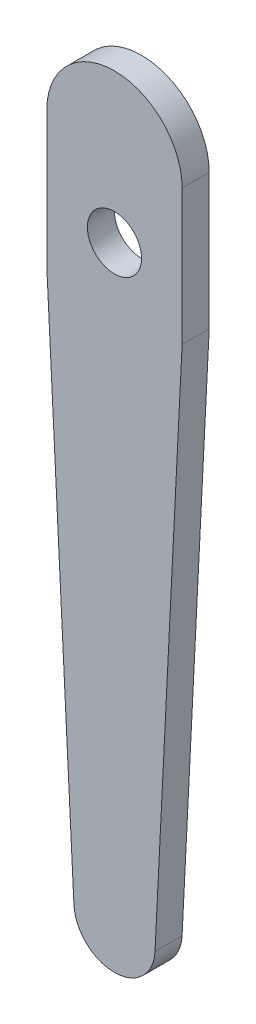
from build123d import *

# Parameters (mm, degrees)
SKETCH1_R           = 15
BOSS_EXTRUDE3_DEPTH = 10
BOSS_EXTRUDE4_DEPTH = 10
SKETCH3_R           = 10
CUT_EXTRUDE1_DEPTH  = 1903.755203621


with BuildPart() as part:
    # Sketch1 → Boss-Extrude3 (new body)
    with BuildSketch(Plane.XY):
        with Locations((6.605137187, -1887.466420258)):
            Circle(SKETCH1_R)
        with BuildLine():
            Line((31.605137187, -1638.974115082), (-18.394862813, -1638.974115082))
            Line((-18.394862813, -1638.974115082), (-18.394862813, -1688.974115082))
            Line((-18.394862813, -1688.974115082), (-8.375934863, -1888.219733093))
            ThreePointArc((-8.375934863, -1888.219733093), (6.228361891, -1872.471152992), (21.605137187, -1887.466420258))
            ThreePointArc((21.605137187, -1887.466420258), (21.600404453, -1887.843195554), (21.586209238, -1888.219733093))
            Line((21.586209238, -1888.219733093), (31.605137187, -1688.974115082))
            Line((31.605137187, -1688.974115082), (31.605137187, -1638.974115082))
        make_face()
    extrude(amount=BOSS_EXTRUDE3_DEPTH)

    # Sketch2 → Boss-Extrude4 (add)
    with BuildSketch(Plane(origin=(0, 0, 0), x_dir=(-1, 0, 0), z_dir=(0, 0, -1))):
        with BuildLine():
            Line((-31.605137187, -1638.974115082), (18.394862813, -1638.974115082))
            ThreePointArc((18.394862813, -1638.974115082), (-6.605137187, -1613.974115082), (-31.605137187, -1638.974115082))
        make_face()
    extrude(amount=-BOSS_EXTRUDE4_DEPTH)

    # Sketch3 → Cut-Extrude1 (cut, through all)
    with BuildSketch(Plane(origin=(0, 0, 0), x_dir=(-1, 0, 0), z_dir=(0, 0, -1))):
        with Locations((-6.605137187, -1668.974115082)):
            Circle(SKETCH3_R)
    extrude(amount=-CUT_EXTRUDE1_DEPTH, mode=Mode.SUBTRACT)


solid = part.part
